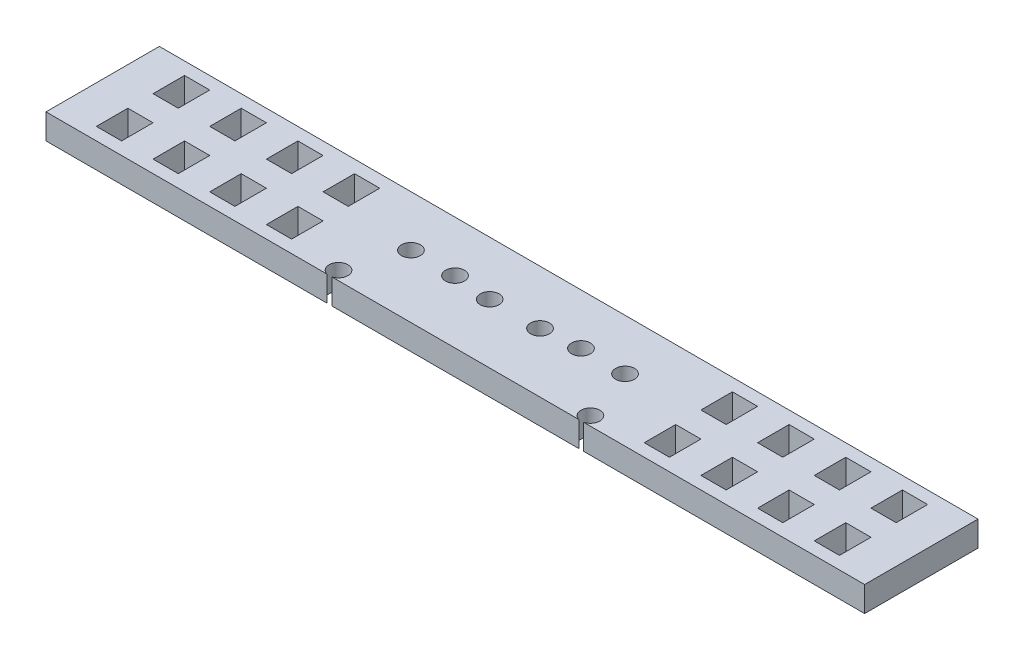
from build123d import *

# Parameters (mm, degrees)
SKETCH1_W           = 130
SKETCH1_H           = 18
BOSS_EXTRUDE1_DEPTH = 4
SKETCH2_W           = 4
SKETCH2_H           = 5
CUT_EXTRUDE1_DEPTH  = 66.741919656
SKETCH3_R           = 1.5
CUT_EXTRUDE2_DEPTH  = 66.741919656
SKETCH4_R           = 1.5
CUT_EXTRUDE3_DEPTH  = 66.741919656


with BuildPart() as part:
    # Sketch1 → Boss-Extrude1 (new body)
    with BuildSketch(Plane(origin=(0, 0, 0), x_dir=(1, 0, 0), z_dir=(0, 1, 0))):
        Rectangle(SKETCH1_W, SKETCH1_H)
    extrude(amount=BOSS_EXTRUDE1_DEPTH)

    # Sketch2 → Cut-Extrude1 (cut, through all)
    with BuildSketch(Plane(origin=(0, 4, 0), x_dir=(1, 0, 0), z_dir=(0, 1, 0))):
        with Locations((57, -4.5)):
            Rectangle(SKETCH2_W, SKETCH2_H)
        with Locations((57, 4.5)):
            Rectangle(SKETCH2_W, SKETCH2_H)
        with Locations((-57, -4.5)):
            Rectangle(SKETCH2_W, SKETCH2_H)
        with Locations((-57, 4.5)):
            Rectangle(SKETCH2_W, SKETCH2_H)
        with Locations((48, -4.5)):
            Rectangle(SKETCH2_W, SKETCH2_H)
        with Locations((48, 4.5)):
            Rectangle(SKETCH2_W, SKETCH2_H)
        with Locations((39, -4.5)):
            Rectangle(SKETCH2_W, SKETCH2_H)
        with Locations((39, 4.5)):
            Rectangle(SKETCH2_W, SKETCH2_H)
        with Locations((30, -4.5)):
            Rectangle(SKETCH2_W, SKETCH2_H)
        with Locations((30, 4.5)):
            Rectangle(SKETCH2_W, SKETCH2_H)
        with Locations((-48, 4.5)):
            Rectangle(SKETCH2_W, SKETCH2_H)
        with Locations((-30, 4.5)):
            Rectangle(SKETCH2_W, SKETCH2_H)
        with Locations((-30, -4.5)):
            Rectangle(SKETCH2_W, SKETCH2_H)
        with Locations((-39, 4.5)):
            Rectangle(SKETCH2_W, SKETCH2_H)
        with Locations((-39, -4.5)):
            Rectangle(SKETCH2_W, SKETCH2_H)
        with Locations((-48, -4.5)):
            Rectangle(SKETCH2_W, SKETCH2_H)
    extrude(amount=-CUT_EXTRUDE1_DEPTH, mode=Mode.SUBTRACT)

    # Sketch3 → Cut-Extrude2 (cut, through all)
    with BuildSketch(Plane.XZ):
        with Locations(Location((17, -0.95, 0), (0, 0, 270))):
            Circle(SKETCH3_R)
        with Locations(Location((-10, -0.95, 0), (0, 0, 270))):
            Circle(SKETCH3_R)
        with Locations(Location((-17, -0.95, 0), (0, 0, 270))):
            Circle(SKETCH3_R)
        with Locations(Location((10, -0.95, 0), (0, 0, 270))):
            Circle(SKETCH3_R)
    extrude(amount=-CUT_EXTRUDE2_DEPTH, mode=Mode.SUBTRACT)

    # Sketch4 → Cut-Extrude3 (cut, through all)
    with BuildSketch(Plane(origin=(0, 4, 0), x_dir=(1, 0, 0), z_dir=(0, 1, 0))):
        with Locations(Location((4, 0.45, 0), (0, 0, 270))):
            Circle(SKETCH4_R)
        with Locations(Location((-4, 0.45, 0), (0, 0, 270))):
            Circle(SKETCH4_R)
        with Locations((-20, -7.55)):
            Circle(SKETCH4_R)
        with Locations((20, -7.55)):
            Circle(SKETCH4_R)
    extrude(amount=-CUT_EXTRUDE3_DEPTH, mode=Mode.SUBTRACT)


solid = part.part
